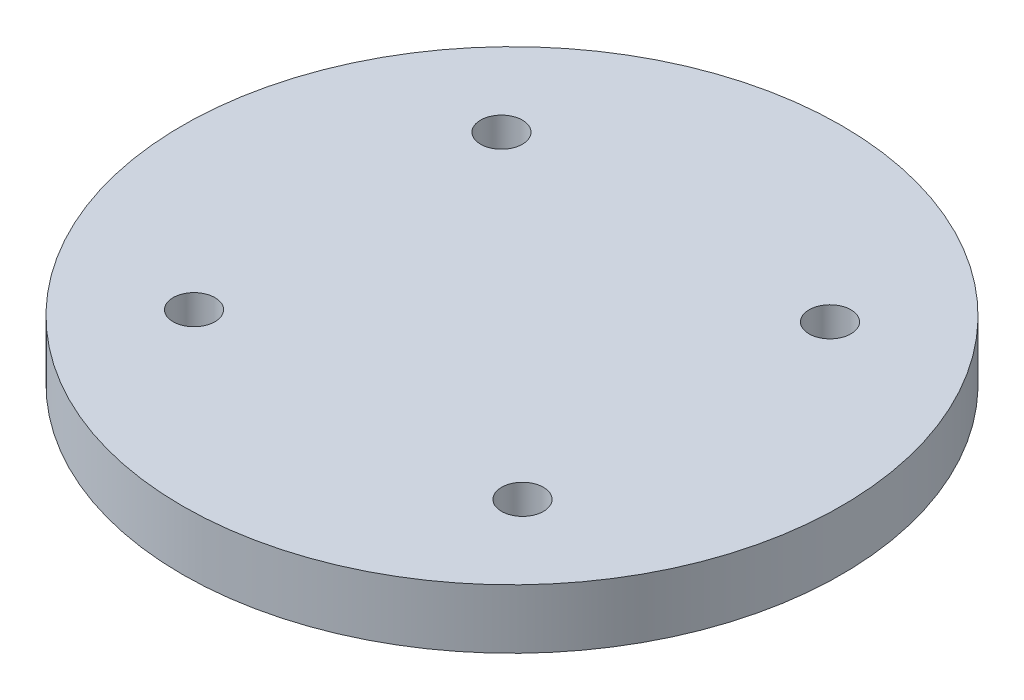
from build123d import *

# Parameters (mm, degrees)
SKETCH1_R           = 50
BOSS_EXTRUDE1_DEPTH = 9
SKETCH2_R           = 3.175
CUT_EXTRUDE1_DEPTH  = 72.281133549


with BuildPart() as part:
    # Sketch1 → Boss-Extrude1 (new body)
    with BuildSketch(Plane(origin=(0, 0, 0), x_dir=(1, 0, 0), z_dir=(0, 1, 0))):
        with Locations(Location((0, 0, 0), (0, 0, 270))):
            Circle(SKETCH1_R)
    extrude(amount=BOSS_EXTRUDE1_DEPTH)

    # Sketch2 → Cut-Extrude1 (cut, through all)
    with BuildSketch(Plane(origin=(0, 9, 0), x_dir=(1, 0, 0), z_dir=(0, 1, 0))):
        with Locations(Location((-24.92, -23.325, 0), (0, 0, 270))):
            Circle(SKETCH2_R)
        with Locations(Location((24.92, -23.325, 0), (0, 0, 90))):
            Circle(SKETCH2_R)
        with Locations(Location((24.92, 23.325, 0), (0, 0, 270))):
            Circle(SKETCH2_R)
        with Locations(Location((-24.92, 23.325, 0), (0, 0, 90))):
            Circle(SKETCH2_R)
    extrude(amount=-CUT_EXTRUDE1_DEPTH, mode=Mode.SUBTRACT)


solid = part.part
